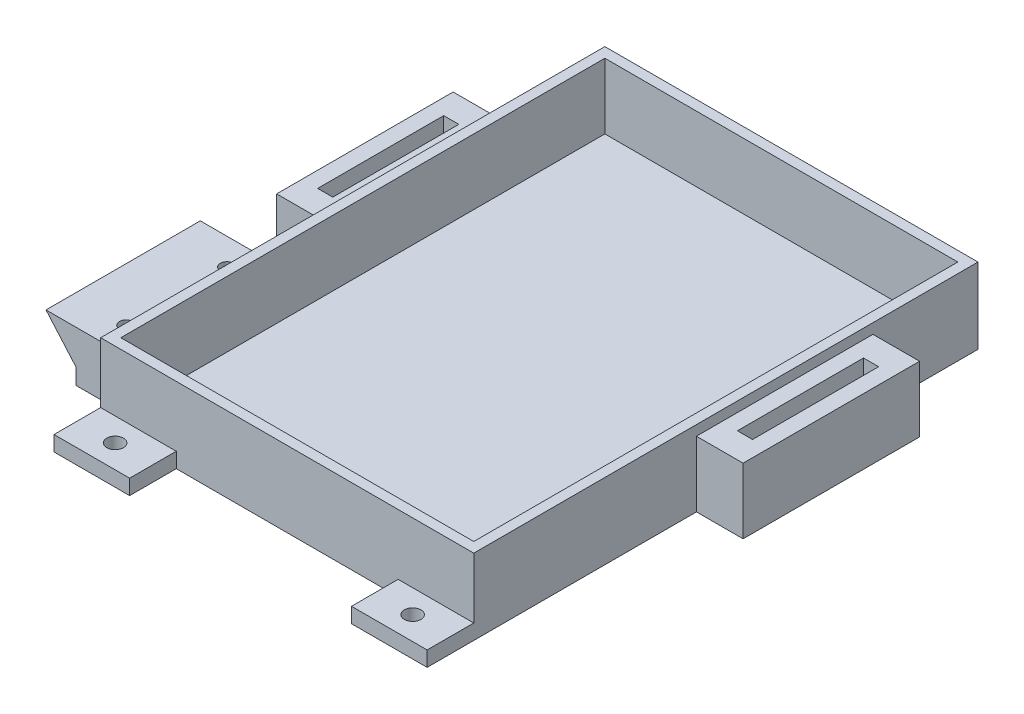
from build123d import *

# Parameters (mm, degrees)
BOSS_EXTRUDE1_DEPTH = 15
SKETCH2_3_W         = 9.25
SKETCH2_3_H         = 15
SKETCH2_3_R         = 1.65
SKETCH2_3_W_2       = 15
SKETCH2_3_H_2       = 9.25
BOSS_EXTRUDE2_DEPTH = 3
SKETCH3_W           = 70
SKETCH3_H           = 96
CUT_EXTRUDE1_DEPTH  = 13
SKETCH5_W           = 9.25
SKETCH5_H           = 30.6
SKETCH5_R           = 1.3
BOSS_EXTRUDE4_DEPTH = 10
BOSS_EXTRUDE5_DEPTH = 30.6
SKETCH9_W           = 9.25
SKETCH9_H           = 35
BOSS_EXTRUDE6_DEPTH = 3
SKETCH9_4_W         = 9.25
SKETCH9_4_H         = 35
SKETCH9_4_W_2       = 3
SKETCH9_4_H_2       = 25
BOSS_EXTRUDE7_DEPTH = 13


with BuildPart() as part:
    # Sketch2 → Boss-Extrude1 (new body)
    with BuildSketch(Plane(origin=(0, 0, 0), x_dir=(1, 0, 0), z_dir=(0, 1, 0))):
        Polygon((9.25, 100), (9.25, 115), (83.25, 115), (83.25, 15), (68.25, 15), (24.25, 15), (9.25, 15), align=None)
    extrude(amount=BOSS_EXTRUDE1_DEPTH)

    # Sketch2<3> → Boss-Extrude2 (add)
    # profile 1 of 3: a face of its own
    with BuildSketch(Plane(origin=(0, 0, 0), x_dir=(1, 0, 0), z_dir=(0, 1, 0))):
        with Locations((4.625, 107.5)):
            Rectangle(SKETCH2_3_W, SKETCH2_3_H)
        with Locations(Location((4.625, 107.5, 0), (0, 0, 270))):
            Circle(SKETCH2_3_R, mode=Mode.SUBTRACT)
    # profile 2 of 3: a face of its own
    with BuildSketch(Plane(origin=(0, 0, 0), x_dir=(1, 0, 0), z_dir=(0, 1, 0))):
        with Locations((16.75, 10.375)):
            Rectangle(SKETCH2_3_W_2, SKETCH2_3_H_2)
        with Locations(Location((16.75, 10.375, 0), (0, 0, 270))):
            Circle(SKETCH2_3_R, mode=Mode.SUBTRACT)
    # profile 3 of 3: a face of its own
    with BuildSketch(Plane(origin=(0, 0, 0), x_dir=(1, 0, 0), z_dir=(0, 1, 0))):
        with Locations((75.75, 10.375)):
            Rectangle(SKETCH2_3_W_2, SKETCH2_3_H_2)
        with Locations(Location((75.75, 10.375, 0), (0, 0, 270))):
            Circle(SKETCH2_3_R, mode=Mode.SUBTRACT)
    extrude(amount=BOSS_EXTRUDE2_DEPTH)

    # Sketch3 → Cut-Extrude1 (cut)
    with BuildSketch(Plane(origin=(0, 15, 0), x_dir=(1, 0, 0), z_dir=(0, 1, 0))):
        with Locations((46.25, 65)):
            Rectangle(SKETCH3_W, SKETCH3_H)
    extrude(amount=-CUT_EXTRUDE1_DEPTH, mode=Mode.SUBTRACT)

    # Sketch5 → Boss-Extrude4 (add)
    with BuildSketch(Plane(origin=(0, 0, 0), x_dir=(1, 0, 0), z_dir=(0, 1, 0))):
        with Locations((4.625, 34.658045924)):
            Rectangle(SKETCH5_W, SKETCH5_H)
        with Locations(Location((4.625, 44.658045924, 0), (0, 0, 270))):
            Circle(SKETCH5_R, mode=Mode.SUBTRACT)
        with Locations(Location((4.625, 24.658045924, 0), (0, 0, 90))):
            Circle(SKETCH5_R, mode=Mode.SUBTRACT)
    extrude(amount=BOSS_EXTRUDE4_DEPTH)

    # Sketch6 → Boss-Extrude5 (add)
    with BuildSketch(Plane(origin=(0, 0, -49.958045924), x_dir=(-1, 0, 0), z_dir=(0, 0, -1))):
        Polygon((0, 3.177665999), (5.942499885, 10), (0, 10), align=None)
    extrude(amount=-BOSS_EXTRUDE5_DEPTH)

    # Sketch9 → Boss-Extrude6 (add)
    with BuildSketch(Plane.XZ):
        with Locations((4.625, -76.661539041)):
            Rectangle(SKETCH9_W, SKETCH9_H)
    boss_extrude6 = extrude(amount=-BOSS_EXTRUDE6_DEPTH)

    # Sketch9<4> → Boss-Extrude7 (add)
    with BuildSketch(Plane.XZ):
        with Locations((4.625, -76.661539041)):
            Rectangle(SKETCH9_4_W, SKETCH9_4_H)
        with Locations((4.625, -76.661539041)):
            Rectangle(SKETCH9_4_W_2, SKETCH9_4_H_2, mode=Mode.SUBTRACT)
    boss_extrude7 = extrude(amount=-BOSS_EXTRUDE7_DEPTH)

    # Mirror1: Boss-Extrude6, Boss-Extrude7 across plane
    add(boss_extrude6.mirror(Plane.ZY.offset(-46.25)))
    add(boss_extrude7.mirror(Plane.ZY.offset(-46.25)))


solid = part.part
